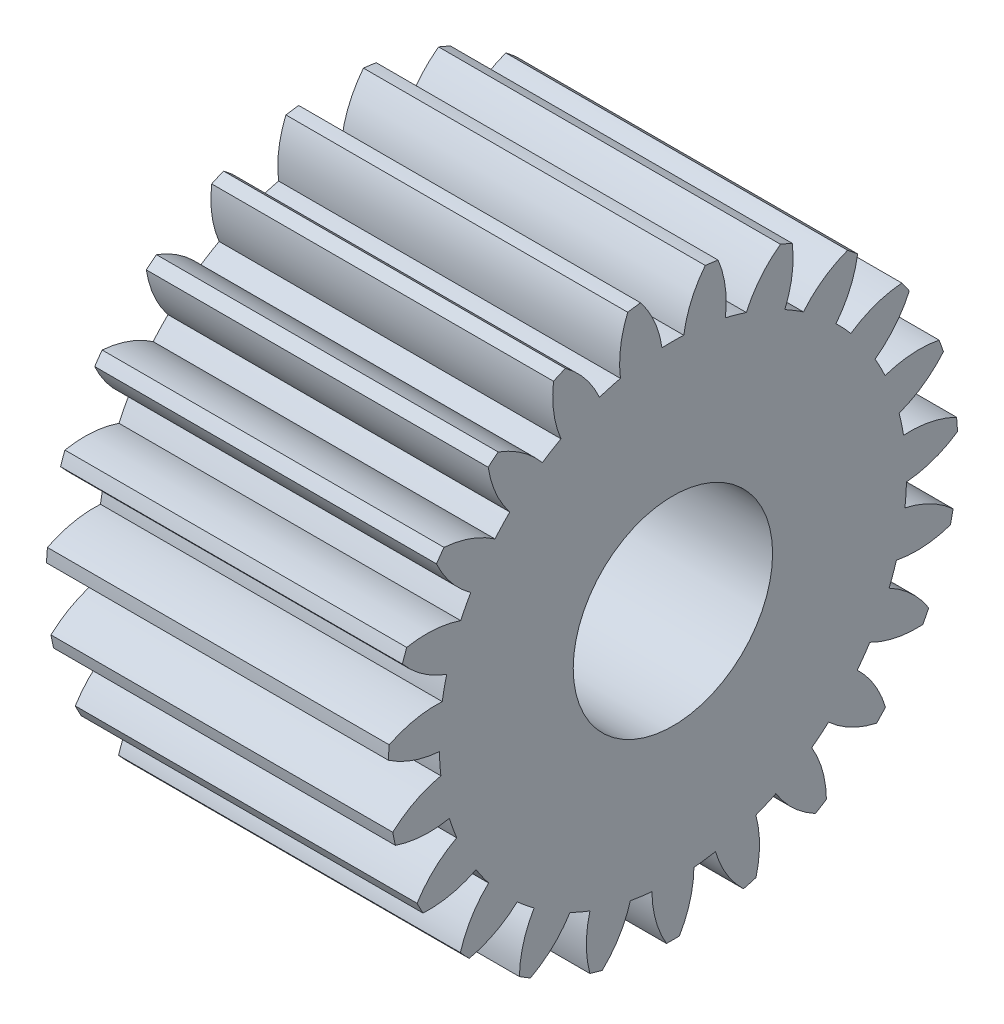
from build123d import *

# Parameters (mm, degrees)
BASPROSKE_W     = 60
BASPROSKE_H     = 50
TOOTHCUT_DEPTH  = 93.736184955
TEETHCUTS_COUNT = 23
TEETHCUTS_ANGLE = 344.347826087
BORSKE_R        = 17.5
BORE_DEPTH      = 60.0000508


with BuildPart() as part:
    # BasProSke → Base-Revolve (revolve)
    with BuildSketch(Plane(origin=(0, 0, 0), x_dir=(1, 0, 0), z_dir=(0, 1, 0)), mode=Mode.PRIVATE) as base_revolve_sk:
        with Locations((30, 25)):
            Rectangle(BASPROSKE_W, BASPROSKE_H)
    revolve(base_revolve_sk.sketch.rotate(Axis((-10, 0, 0), (1, 0, 0)), 180), axis=Axis((-10, 0, 0), (1, 0, 0)))

    # TooCutSke → ToothCut (cut, through all)
    with BuildSketch(Plane(origin=(0, 0, 0), x_dir=(0, 0, -1), z_dir=(1, 0, 0))):
        with BuildLine():
            ThreePointArc((1.90971626, 40.954498957), (0, 40.999), (-1.90971626, 40.954498957))
            ThreePointArc((-1.90971626, 40.954498957), (-3.228022445, 45.57670564), (-5.698439072, 49.699783071))
            ThreePointArc((-5.698439072, 49.699783071), (0, 50.0254), (5.698439072, 49.699783071))
            ThreePointArc((5.698439072, 49.699783071), (3.228022445, 45.57670564), (1.90971626, 40.954498957))
        make_face()
    toothcut = extrude(amount=TOOTHCUT_DEPTH, mode=Mode.SUBTRACT)

    # TeethCuts: ToothCut ×23 about axis
    teethcuts_axis = Axis((-10, 0, 0), (1, 0, 0))
    for i in range(1, TEETHCUTS_COUNT):
        add(toothcut.rotate(teethcuts_axis, i * TEETHCUTS_ANGLE / (TEETHCUTS_COUNT - 1)), mode=Mode.SUBTRACT)

    # BorSke → Bore (cut, symmetric)
    with BuildSketch(Plane(origin=(0, 0, 0), x_dir=(0, 0, -1), z_dir=(1, 0, 0))):
        with Locations(Location((0, 0, 0), (0, 0, 180))):
            Circle(BORSKE_R)
    extrude(amount=BORE_DEPTH, both=True, mode=Mode.SUBTRACT)


solid = part.part
